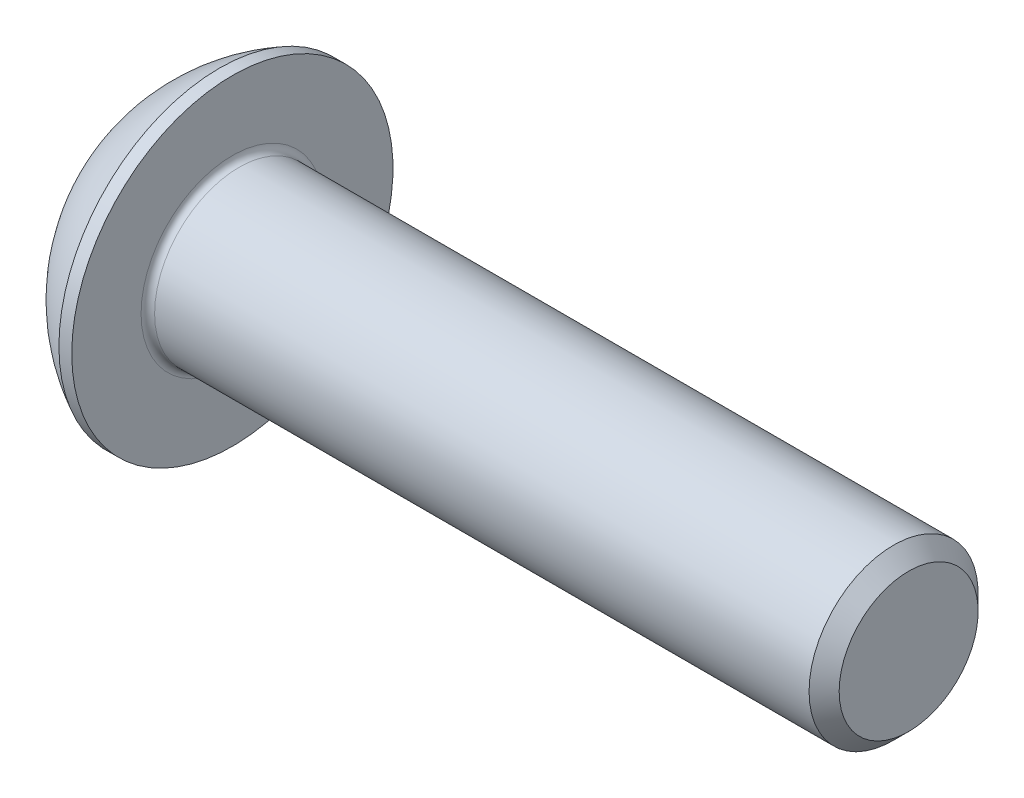
from build123d import *

# Parameters (mm, degrees)
FILLET1_R   = 0.2
HEX_2_DEPTH = 1.56


with BuildPart() as part:
    # BodySke → BaseBody (revolve)
    with BuildSketch(Plane.XY, mode=Mode.PRIVATE) as basebody_sk:
        with BuildLine():
            Line((22.75, 0), (22.75, 2.055))
            Line((22.75, 2.055), (22.305, 2.5))
            Line((22.305, 2.5), (2.75, 2.5))
            Line((2.75, 2.5), (2.75, 4.75))
            Line((2.75, 4.75), (2.37, 4.75))
            ThreePointArc((2.37, 4.75), (0.992680215, 3.754414901), (0, 2.375))
            Line((0, 2.375), (0, 0))
            Line((0, 0), (22.75, 0))
        make_face()
    revolve(basebody_sk.sketch.rotate(Axis((0, 0, 0), (1, 0, 0)), 90), axis=Axis((0, 0, 0), (1, 0, 0)))

    # Fillet1
    fillet1_edges = [part.edges().sort_by_distance(p)[0] for p in [
        (2.75, 0, -2.5),
    ]]
    fillet(fillet1_edges, radius=FILLET1_R)

    # Sketch2 → PreBroach (revolve, cut)
    with BuildSketch(Plane.XY, mode=Mode.PRIVATE) as prebroach_sk:
        Polygon((0, 1.5), (1.56, 1.5), (2.426025404, 0), (0, 0), align=None)
    revolve(prebroach_sk.sketch.rotate(Axis((0, 0, 0), (1, 0, 0)), 90), axis=Axis((0, 0, 0), (1, 0, 0)), mode=Mode.SUBTRACT)

    # Sketch3 → Hex 2 (cut)
    with BuildSketch(Plane(origin=(0, 0, 0), x_dir=(0, 0, -1), z_dir=(1, 0, 0))):
        Polygon((-1.5, -0.866025404), (-1.5, 0.866025404), (0, 1.732050808), (1.5, 0.866025404), (1.5, -0.866025404), (0, -1.732050808), align=None)
    extrude(amount=HEX_2_DEPTH, mode=Mode.SUBTRACT)


solid = part.part
